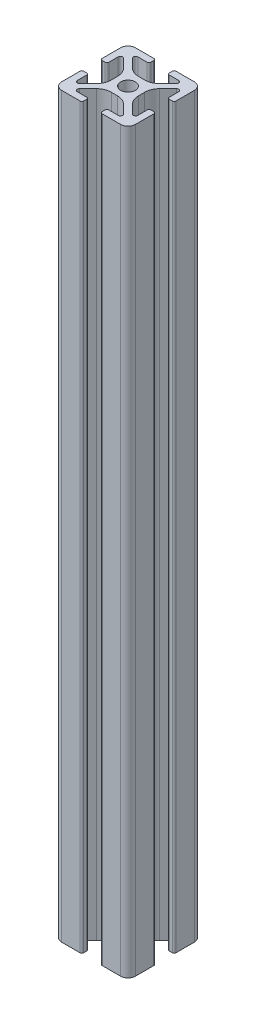
from build123d import *

# Parameters (mm, degrees)
SKETCH1_R           = 2
BOSS_EXTRUDE1_DEPTH = 200


with BuildPart() as part:
    # Sketch1 → Boss-Extrude1 (new body)
    with BuildSketch(Plane(origin=(0, 0, 0), x_dir=(1, 0, 0), z_dir=(0, 1, 0))):
        with BuildLine():
            Line((2.824264069, 15.973654403), (5.128427125, 13.669491347))
            ThreePointArc((5.128427125, 13.669491347), (5.99551813, 12.371797952), (6.3, 10.841064222))
            Line((6.3, 10.841064222), (6.3, 9.158935778))
            ThreePointArc((6.3, 9.158935778), (5.99551813, 7.628202048), (5.128427125, 6.330508653))
            Line((5.128427125, 6.330508653), (2.824264069, 4.026345597))
            ThreePointArc((2.824264069, 4.026345597), (2.170389941, 3.896281946), (1.8, 4.450609665))
            Line((1.8, 4.450609665), (1.8, 7))
            ThreePointArc((1.8, 7), (1.653553391, 7.353553391), (1.3, 7.5))
            Line((1.3, 7.5), (0.5, 7.5))
            ThreePointArc((0.5, 7.5), (0.146446609, 7.353553391), (0, 7))
            Line((0, 7), (0, 2))
            ThreePointArc((0, 2), (0.585786438, 0.585786438), (2, 0))
            Line((2, 0), (7, 0))
            ThreePointArc((7, 0), (7.353553391, 0.146446609), (7.5, 0.5))
            Line((7.5, 0.5), (7.5, 1.3))
            ThreePointArc((7.5, 1.3), (7.353553391, 1.653553391), (7, 1.8))
            Line((7, 1.8), (4.450609665, 1.8))
            ThreePointArc((4.450609665, 1.8), (3.896281946, 2.170389941), (4.026345597, 2.824264069))
            Line((4.026345597, 2.824264069), (6.330508653, 5.128427125))
            ThreePointArc((6.330508653, 5.128427125), (7.628202048, 5.99551813), (9.158935778, 6.3))
            Line((9.158935778, 6.3), (10.841064222, 6.3))
            ThreePointArc((10.841064222, 6.3), (12.371797952, 5.99551813), (13.669491347, 5.128427125))
            Line((13.669491347, 5.128427125), (15.973654403, 2.824264069))
            ThreePointArc((15.973654403, 2.824264069), (16.103718054, 2.170389941), (15.549390335, 1.8))
            Line((15.549390335, 1.8), (13, 1.8))
            ThreePointArc((13, 1.8), (12.646446609, 1.653553391), (12.5, 1.3))
            Line((12.5, 1.3), (12.5, 0.5))
            ThreePointArc((12.5, 0.5), (12.646446609, 0.146446609), (13, 0))
            Line((13, 0), (18, 0))
            ThreePointArc((18, 0), (19.414213562, 0.585786438), (20, 2))
            Line((20, 2), (20, 7))
            ThreePointArc((20, 7), (19.853553391, 7.353553391), (19.5, 7.5))
            Line((19.5, 7.5), (18.7, 7.5))
            ThreePointArc((18.7, 7.5), (18.346446609, 7.353553391), (18.2, 7))
            Line((18.2, 7), (18.2, 4.450609665))
            ThreePointArc((18.2, 4.450609665), (17.829610059, 3.896281946), (17.175735931, 4.026345597))
            Line((17.175735931, 4.026345597), (14.871572875, 6.330508653))
            ThreePointArc((14.871572875, 6.330508653), (14.00448187, 7.628202048), (13.7, 9.158935778))
            Line((13.7, 9.158935778), (13.7, 10.841064222))
            ThreePointArc((13.7, 10.841064222), (14.00448187, 12.371797952), (14.871572875, 13.669491347))
            Line((14.871572875, 13.669491347), (17.175735931, 15.973654403))
            ThreePointArc((17.175735931, 15.973654403), (17.829610059, 16.103718054), (18.2, 15.549390335))
            Line((18.2, 15.549390335), (18.2, 13))
            ThreePointArc((18.2, 13), (18.346446609, 12.646446609), (18.7, 12.5))
            Line((18.7, 12.5), (19.5, 12.5))
            ThreePointArc((19.5, 12.5), (19.853553391, 12.646446609), (20, 13))
            Line((20, 13), (20, 18))
            ThreePointArc((20, 18), (19.414213562, 19.414213562), (18, 20))
            Line((18, 20), (13, 20))
            ThreePointArc((13, 20), (12.646446609, 19.853553391), (12.5, 19.5))
            Line((12.5, 19.5), (12.5, 18.7))
            ThreePointArc((12.5, 18.7), (12.646446609, 18.346446609), (13, 18.2))
            Line((13, 18.2), (15.549390335, 18.2))
            ThreePointArc((15.549390335, 18.2), (16.103718054, 17.829610059), (15.973654403, 17.175735931))
            Line((15.973654403, 17.175735931), (13.669491347, 14.871572875))
            ThreePointArc((13.669491347, 14.871572875), (12.371797952, 14.00448187), (10.841064222, 13.7))
            Line((10.841064222, 13.7), (9.158935778, 13.7))
            ThreePointArc((9.158935778, 13.7), (7.628202048, 14.00448187), (6.330508653, 14.871572875))
            Line((6.330508653, 14.871572875), (4.026345597, 17.175735931))
            ThreePointArc((4.026345597, 17.175735931), (3.896281946, 17.829610059), (4.450609665, 18.2))
            Line((4.450609665, 18.2), (7, 18.2))
            ThreePointArc((7, 18.2), (7.353553391, 18.346446609), (7.5, 18.7))
            Line((7.5, 18.7), (7.5, 19.5))
            ThreePointArc((7.5, 19.5), (7.353553391, 19.853553391), (7, 20))
            Line((7, 20), (2, 20))
            ThreePointArc((2, 20), (0.585786438, 19.414213562), (0, 18))
            Line((0, 18), (0, 13))
            ThreePointArc((0, 13), (0.146446609, 12.646446609), (0.5, 12.5))
            Line((0.5, 12.5), (1.3, 12.5))
            ThreePointArc((1.3, 12.5), (1.653553391, 12.646446609), (1.8, 13))
            Line((1.8, 13), (1.8, 15.549390335))
            ThreePointArc((1.8, 15.549390335), (2.170389941, 16.103718054), (2.824264069, 15.973654403))
        make_face()
        with Locations(Location((10, 10, 0), (0, 0, 270))):
            Circle(SKETCH1_R, mode=Mode.SUBTRACT)
    extrude(amount=-BOSS_EXTRUDE1_DEPTH)


solid = part.part
